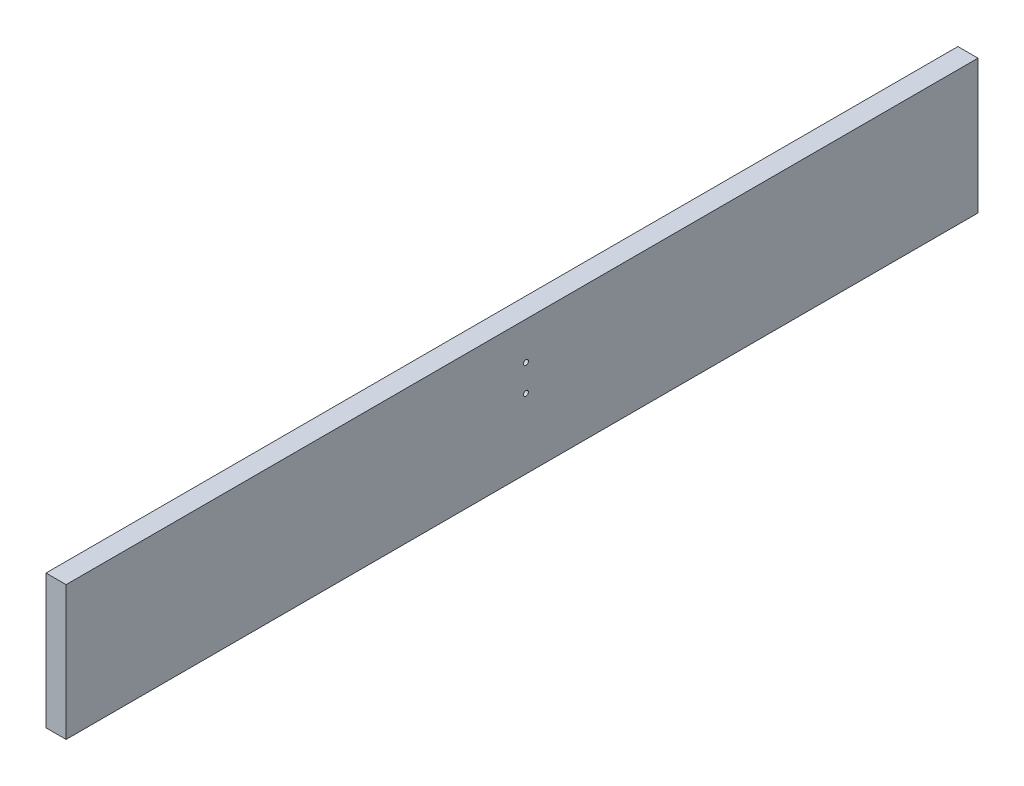
from build123d import *

# Parameters (mm, degrees)
SKETCH1_W           = 19.05
SKETCH1_H           = 127
BOSS_EXTRUDE1_DEPTH = 863.6
SKETCH2_R           = 2.38125
CUT_EXTRUDE1_DEPTH  = 867.140931085


with BuildPart() as part:
    # Sketch1 → Boss-Extrude1 (new body)
    with BuildSketch(Plane.XY):
        Rectangle(SKETCH1_W, SKETCH1_H)
    extrude(amount=BOSS_EXTRUDE1_DEPTH)

    # Sketch2 → Cut-Extrude1 (cut, through all)
    with BuildSketch(Plane.ZY.offset(9.525)):
        with Locations(Location((428.139617684, 2.54, 0), (0, 0, 270))):
            Circle(SKETCH2_R)
        with Locations(Location((428.139617684, 27.94, 0), (0, 0, 270))):
            Circle(SKETCH2_R)
    extrude(amount=-CUT_EXTRUDE1_DEPTH, mode=Mode.SUBTRACT)


solid = part.part
